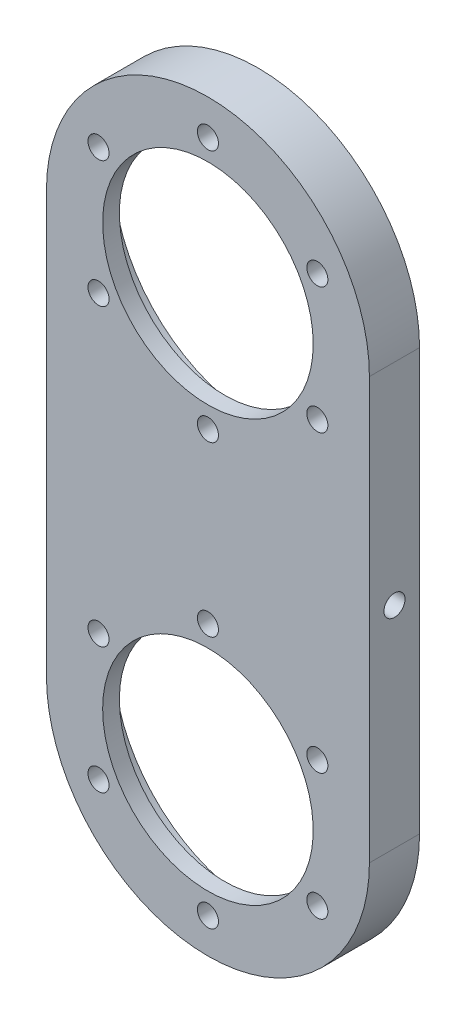
from build123d import *

# Parameters (mm, degrees)
SKETCH1_R           = 27.5
BOSS_EXTRUDE1_DEPTH = 9.525
BOSS_EXTRUDE2_START = -3.175
SKETCH2_R           = 20
SKETCH2_R_2         = 2
BOSS_EXTRUDE2_DEPTH = 3.175
SKETCH8_R           = 2
CUT_EXTRUDE6_DEPTH  = 52.5


with BuildPart() as part:
    # Sketch1 → Boss-Extrude1 (new body)
    with BuildSketch(Plane.XY):
        with BuildLine():
            Line((-30.675000233, 40), (-30.675000233, -40))
            ThreePointArc((-30.675000233, -40), (0, -70.675000233), (30.675000233, -40))
            Line((30.675000233, -40), (30.675000233, 40))
            ThreePointArc((30.675000233, 40), (0, 70.675000233), (-30.675000233, 40))
        make_face()
        with Locations(Location((0, 40, 0), (0, 0, 180))):
            Circle(SKETCH1_R, mode=Mode.SUBTRACT)
        with Locations(Location((0, -40, 0), (0, 0, 180))):
            Circle(SKETCH1_R, mode=Mode.SUBTRACT)
    extrude(amount=BOSS_EXTRUDE1_DEPTH)

    # Sketch2 → Boss-Extrude2 (add)
    with BuildSketch(Plane.XY.offset(9.525).offset(BOSS_EXTRUDE2_START)):
        with BuildLine():
            Line((-30.675000233, 40), (-30.675000233, -40))
            ThreePointArc((-30.675000233, -40), (0, -70.675000233), (30.675000233, -40))
            Line((30.675000233, -40), (30.675000233, 40))
            ThreePointArc((30.675000233, 40), (0, 70.675000233), (-30.675000233, 40))
        make_face()
        with Locations((0, 40)):
            Circle(SKETCH2_R, mode=Mode.SUBTRACT)
        with Locations((0, 64)):
            Circle(SKETCH2_R_2, mode=Mode.SUBTRACT)
        with Locations((20.784609691, 52)):
            Circle(SKETCH2_R_2, mode=Mode.SUBTRACT)
        with Locations((20.784609691, 28)):
            Circle(SKETCH2_R_2, mode=Mode.SUBTRACT)
        with Locations((0, 16)):
            Circle(SKETCH2_R_2, mode=Mode.SUBTRACT)
        with Locations((-20.784609691, 28)):
            Circle(SKETCH2_R_2, mode=Mode.SUBTRACT)
        with Locations((-20.784609691, 52)):
            Circle(SKETCH2_R_2, mode=Mode.SUBTRACT)
        with Locations(Location((-20.784609691, -52, 0), (0, 0, 180))):
            Circle(SKETCH2_R_2, mode=Mode.SUBTRACT)
        with Locations(Location((-20.784609691, -28, 0), (0, 0, 180))):
            Circle(SKETCH2_R_2, mode=Mode.SUBTRACT)
        with Locations(Location((0, -16, 0), (0, 0, 180))):
            Circle(SKETCH2_R_2, mode=Mode.SUBTRACT)
        with Locations(Location((20.784609691, -28, 0), (0, 0, 180))):
            Circle(SKETCH2_R_2, mode=Mode.SUBTRACT)
        with Locations(Location((20.784609691, -52, 0), (0, 0, 180))):
            Circle(SKETCH2_R_2, mode=Mode.SUBTRACT)
        with Locations(Location((0, -64, 0), (0, 0, 180))):
            Circle(SKETCH2_R_2, mode=Mode.SUBTRACT)
        with Locations(Location((0, -40, 0), (0, 0, 180))):
            Circle(SKETCH2_R, mode=Mode.SUBTRACT)
    extrude(amount=BOSS_EXTRUDE2_DEPTH)

    # Sketch8 → Cut-Extrude6 (cut, symmetric)
    with BuildSketch(Plane(origin=(0, 0, 0), x_dir=(0, 0, -1), z_dir=(1, 0, 0))):
        with Locations((-4.7625, 0)):
            Circle(SKETCH8_R)
    extrude(amount=CUT_EXTRUDE6_DEPTH, both=True, mode=Mode.SUBTRACT)


solid = part.part
